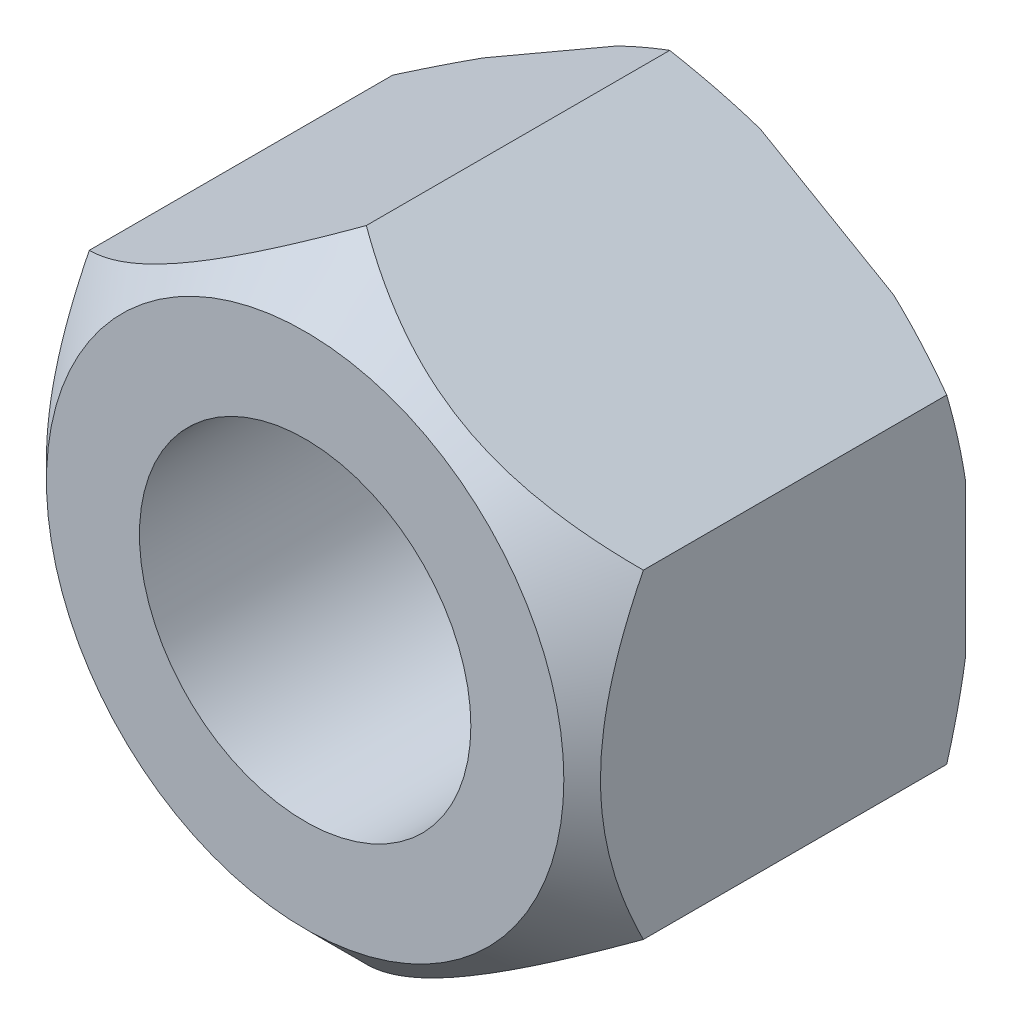
from build123d import *

# Parameters (mm, degrees)
SKETCH_1_R          = 5.188125
EXTRUDE_558_DEPTH   = 12
SKETCH_2_OUTSIDE_W  = 90.55
SKETCH_2_OUTSIDE_H  = 93.234
SKETCH_2_OUTSIDE_R  = 9
CUT_EXTRUDE_1_DEPTH = 18.87527325
CUT_EXTRUDE_1_DRAFT = -60
CHAMFER_1_SIZE      = 0.196428571
SKETCH_9_OUTSIDE_W  = 62.914
SKETCH_9_OUTSIDE_H  = 65.598
SKETCH_9_OUTSIDE_R  = 8.1
CUT_EXTRUDE_7_DEPTH = 18.87527325
CUT_EXTRUDE_7_DRAFT = -45


with BuildPart() as part:
    # 草图1 → Extrude 558 (new body)
    with BuildSketch(Plane.XY):
        Polygon((0, 10.015), (-8.673244419, 5.0075), (-8.673244419, -5.0075), (0, -10.015), (8.673244419, -5.0075), (8.673244419, 5.0075), align=None)
        Circle(SKETCH_1_R, mode=Mode.SUBTRACT)
    extrude(amount=EXTRUDE_558_DEPTH)


with BuildPart() as cut_extrude_1_tool:
    # 草图2 outside → 切除-拉伸1 (with draft: the straight prism first)
    with BuildSketch(Plane(origin=(0, 0, 0), x_dir=(-1, 0, 0), z_dir=(0, 0, -1))):
        Rectangle(SKETCH_2_OUTSIDE_W, SKETCH_2_OUTSIDE_H)
        Circle(SKETCH_2_OUTSIDE_R, mode=Mode.SUBTRACT)
    extrude(amount=-CUT_EXTRUDE_1_DEPTH)
    # 切除-拉伸1: the draft: its side faces are tilted about the plane it starts from
    cut_extrude_1_sides = [cut_extrude_1_tool.faces().sort_by_distance(p)[0] for p in [
        (0, -46.617, 9.437636625),
        (-45.275, 0, 9.437636625),
        (0, 46.617, 9.437636625),
        (45.275, 0, 9.437636625),
        (9, 0, 9.437636625),
    ]]
    draft(cut_extrude_1_sides, Plane(origin=(0, 0, 0), x_dir=(-1, 0, 0), z_dir=(0, 0, -1)), CUT_EXTRUDE_1_DRAFT)


with BuildPart() as part_1:
    add(part.part)

    # 切除-拉伸1: cut by cut_extrude_1_tool
    add(cut_extrude_1_tool.part, mode=Mode.SUBTRACT)

    # 倒角1
    chamfer_1_edges = [part_1.edges().sort_by_distance(p)[0] for p in [
        (-5.188125, 0, 0),
    ]]
    chamfer(chamfer_1_edges, length=CHAMFER_1_SIZE)


with BuildPart() as cut_extrude_7_tool:
    # 草图9 outside → 切除-拉伸7 (with draft: the straight prism first)
    with BuildSketch(Plane.XY.offset(12)):
        Rectangle(SKETCH_9_OUTSIDE_W, SKETCH_9_OUTSIDE_H)
        Circle(SKETCH_9_OUTSIDE_R, mode=Mode.SUBTRACT)
    extrude(amount=-CUT_EXTRUDE_7_DEPTH)
    # 切除-拉伸7: the draft: its side faces are tilted about the plane it starts from
    cut_extrude_7_sides = [cut_extrude_7_tool.faces().sort_by_distance(p)[0] for p in [
        (0, -32.799, 2.562363375),
        (31.457, 0, 2.562363375),
        (0, 32.799, 2.562363375),
        (-31.457, 0, 2.562363375),
        (-8.1, 0, 2.562363375),
    ]]
    draft(cut_extrude_7_sides, Plane.XY.offset(12), CUT_EXTRUDE_7_DRAFT)


with BuildPart() as part_2:
    add(part_1.part)

    # 切除-拉伸7: cut by cut_extrude_7_tool
    add(cut_extrude_7_tool.part, mode=Mode.SUBTRACT)


solid = part_2.part
